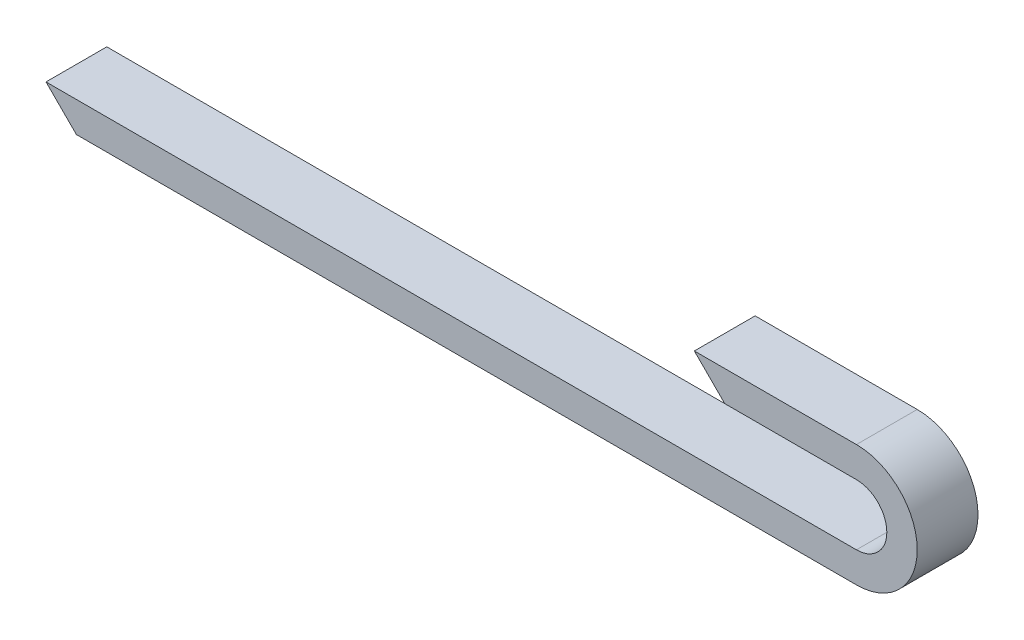
from build123d import *

# Parameters (mm, degrees)
EXTRUDE_1_DEPTH = 30
SCALE_1_SCALE   = 1.7


with BuildPart() as part:
    # 草图1 → 凸台-拉伸1 (new body)
    with BuildSketch(Plane.XY):
        with BuildLine():
            Line((111.300105962, 44.956400142), (126.300105962, 29.956400142))
            Line((126.300105962, 29.956400142), (191.300105962, 29.956400142))
            ThreePointArc((191.300105962, 29.956400142), (206.300105962, 14.956400142), (191.300105962, -0.043599858))
            Line((191.300105962, -0.043599858), (-208.699894038, -0.043599858))
            Line((-208.699894038, -0.043599858), (-193.699894038, -15.043599858))
            Line((-193.699894038, -15.043599858), (191.300105962, -15.043599858))
            ThreePointArc((191.300105962, -15.043599858), (221.300105962, 14.956400142), (191.300105962, 44.956400142))
            Line((191.300105962, 44.956400142), (111.300105962, 44.956400142))
        make_face()
    extrude(amount=-EXTRUDE_1_DEPTH)


with BuildPart() as part_1:
    # 缩放比例1: scaled about (0, 0, 0)
    add(part.part.scale(SCALE_1_SCALE))


solid = part_1.part
